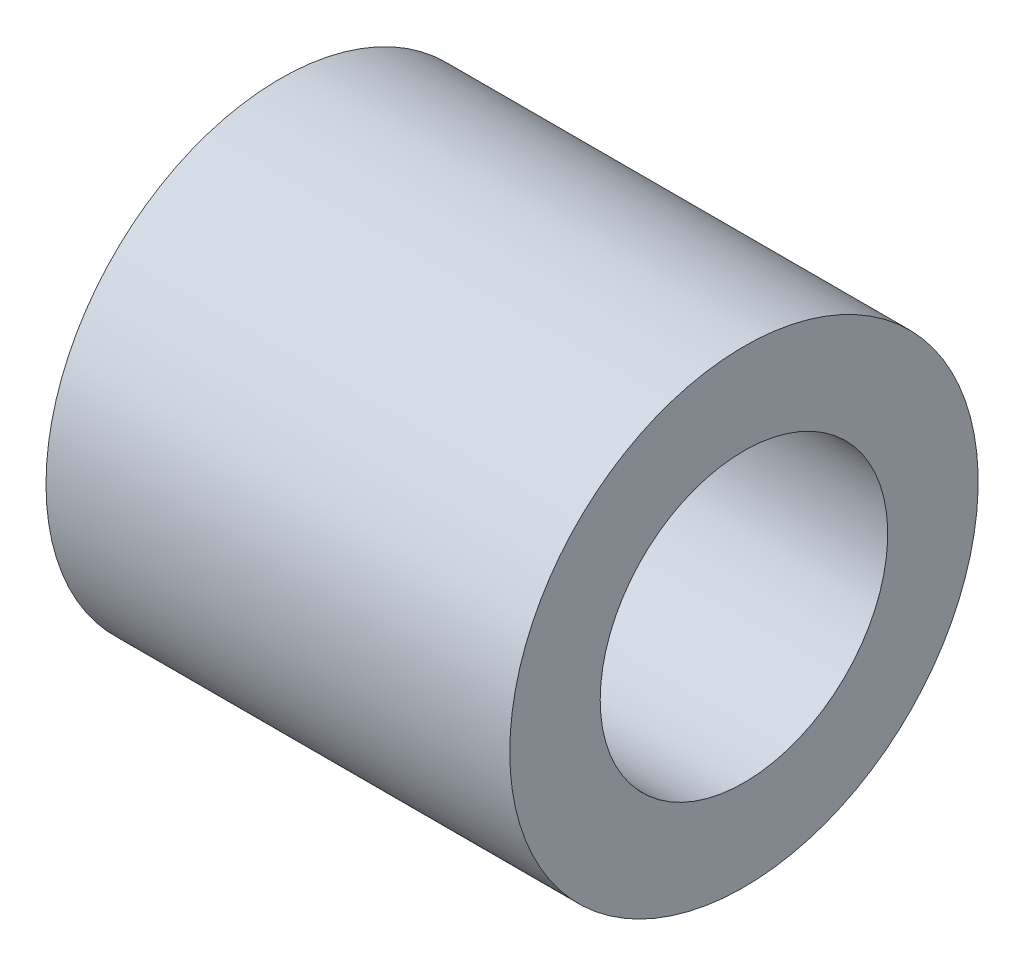
from build123d import *

# Parameters (mm, degrees)
SKETCH1_W = 12.7
SKETCH1_H = 2.4765


with BuildPart() as part:
    # Sketch1 → Revolve1 (revolve)
    with BuildSketch(Plane.XY, mode=Mode.PRIVATE) as revolve1_sk:
        with Locations((6.35, 5.17525)):
            Rectangle(SKETCH1_W, SKETCH1_H)
    revolve(revolve1_sk.sketch.rotate(Axis((0, 0, 0), (1, 0, 0)), 90), axis=Axis((0, 0, 0), (1, 0, 0)))


solid = part.part
